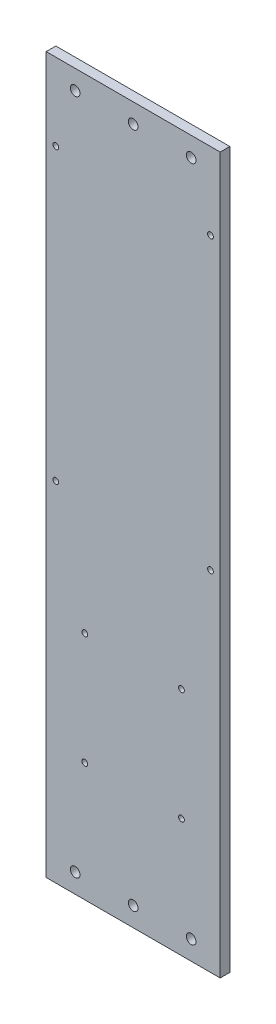
from build123d import *

# Parameters (mm, degrees)
SKETCH_2_W          = 90
SKETCH_2_H          = 370
EXTRUDE_1_DEPTH     = 2.5
SKETCH_3_R          = 2.5
CUT_EXTRUDE_1_DEPTH = 191.459969547
SKETCH_5_R          = 1.5
CUT_EXTRUDE_3_DEPTH = 191.459969547
SKETCH_6_R          = 1.5
CUT_EXTRUDE_4_DEPTH = 191.459969547


with BuildPart() as part:
    # 草图2 → 凸台-拉伸1 (new, symmetric)
    with BuildSketch(Plane.XY):
        Rectangle(SKETCH_2_W, SKETCH_2_H)
    extrude(amount=EXTRUDE_1_DEPTH, both=True)

    # 草图3 → 切除-拉伸1 (cut, through all)
    with BuildSketch(Plane.XY.offset(2.5)):
        with Locations((0, 175)):
            Circle(SKETCH_3_R)
        with Locations((30, 175)):
            Circle(SKETCH_3_R)
        with Locations((-30, 175)):
            Circle(SKETCH_3_R)
        with Locations(Location((-30, -175, 0), (0, 0, 180))):
            Circle(SKETCH_3_R)
        with Locations(Location((30, -175, 0), (0, 0, 180))):
            Circle(SKETCH_3_R)
        with Locations(Location((0, -175, 0), (0, 0, 180))):
            Circle(SKETCH_3_R)
    extrude(amount=-CUT_EXTRUDE_1_DEPTH, mode=Mode.SUBTRACT)

    # 草图5 → 切除-拉伸3 (cut, through all)
    with BuildSketch(Plane.XY.offset(2.5)):
        with Locations((40, 145.172802193)):
            Circle(SKETCH_5_R)
        with Locations(Location((-40, 145.172802193, 0), (0, 0, 180))):
            Circle(SKETCH_5_R)
        with Locations((-40, -4.827197807)):
            Circle(SKETCH_5_R)
        with Locations(Location((40, -4.827197807, 0), (0, 0, 180))):
            Circle(SKETCH_5_R)
    extrude(amount=-CUT_EXTRUDE_3_DEPTH, mode=Mode.SUBTRACT)

    # 草图6 → 切除-拉伸4 (cut, through all)
    with BuildSketch(Plane.XY.offset(2.5)):
        with Locations((25, -123.576005542)):
            Circle(SKETCH_6_R)
        with Locations(Location((-25, -123.576005542, 0), (0, 0, 180))):
            Circle(SKETCH_6_R)
        with Locations(Location((25, -65.576005542, 0), (0, 0, 180))):
            Circle(SKETCH_6_R)
        with Locations((-25, -65.576005542)):
            Circle(SKETCH_6_R)
    extrude(amount=-CUT_EXTRUDE_4_DEPTH, mode=Mode.SUBTRACT)


solid = part.part
